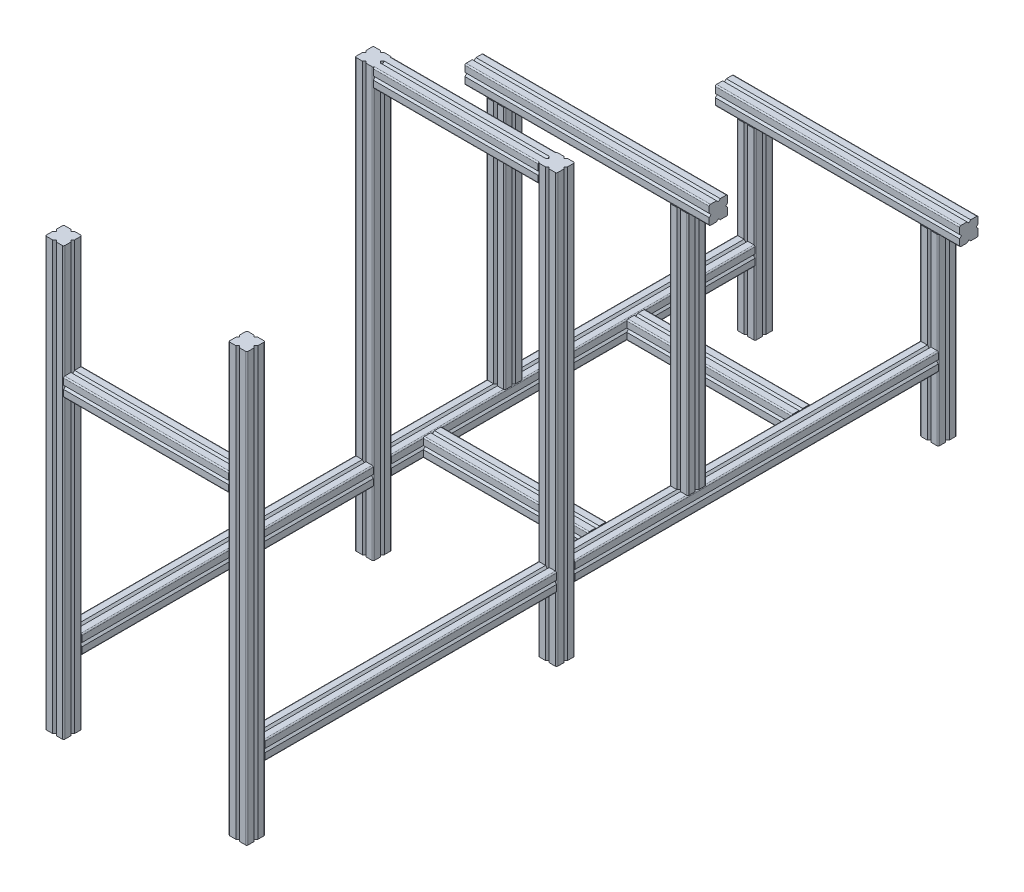
from build123d import *

# Parameters (mm, degrees)
EXTRUDE_1_DEPTH   = 700
EXTRUDE_1_2_DEPTH = 700
EXTRUDE_2_DEPTH   = 300
EXTRUDE_2_2_DEPTH = 300
EXTRUDE_3_DEPTH   = 700
EXTRUDE_3_2_DEPTH = 700
EXTRUDE_5_DEPTH   = 595
EXTRUDE_6_DEPTH   = 477
EXTRUDE_7_DEPTH   = 400
EXTRUDE_8_DEPTH   = 135
EXTRUDE_9_DEPTH   = 200


with BuildPart() as part:
    # 스케치1 → 보스-돌출1 (new body)
    with BuildSketch(Plane(origin=(0, 0, 0), x_dir=(1, 0, 0), z_dir=(0, 1, 0))):
        with BuildLine():
            Line((-163, 15), (-153, 15))
            Line((-153, 15), (-150, 12))
            Line((-150, 12), (-147, 15))
            Line((-147, 15), (-137, 15))
            ThreePointArc((-137, 15), (-135.585786438, 14.414213562), (-135, 13))
            Line((-135, 13), (-135, 3))
            Line((-135, 3), (-138, 0))
            Line((-138, 0), (-135, -3))
            Line((-135, -3), (-135, -13))
            ThreePointArc((-135, -13), (-135.585786438, -14.414213562), (-137, -15))
            Line((-137, -15), (-147, -15))
            Line((-147, -15), (-150, -12))
            Line((-150, -12), (-153, -15))
            Line((-153, -15), (-163, -15))
            ThreePointArc((-163, -15), (-164.414213562, -14.414213562), (-165, -13))
            Line((-165, -13), (-165, -3))
            Line((-165, -3), (-162, 0))
            Line((-162, 0), (-165, 3))
            Line((-165, 3), (-165, 13))
            ThreePointArc((-165, 13), (-164.414213562, 14.414213562), (-163, 15))
        make_face()
    extrude(amount=EXTRUDE_1_DEPTH)



with BuildPart() as body_2:
    # 스케치1 → Extrude 1 2 (new body)
    with BuildSketch(Plane(origin=(0, 0, 0), x_dir=(1, 0, 0), z_dir=(0, 1, 0))):
        with BuildLine():
            Line((147, -15), (137, -15))
            ThreePointArc((137, -15), (135.585786438, -14.414213562), (135, -13))
            Line((135, -13), (135, -3))
            Line((135, -3), (138, 0))
            Line((138, 0), (135, 3))
            Line((135, 3), (135, 13))
            ThreePointArc((135, 13), (135.585786438, 14.414213562), (137, 15))
            Line((137, 15), (147, 15))
            Line((147, 15), (150, 12))
            Line((150, 12), (153, 15))
            Line((153, 15), (163, 15))
            ThreePointArc((163, 15), (164.414213562, 14.414213562), (165, 13))
            Line((165, 13), (165, 3))
            Line((165, 3), (162, 0))
            Line((162, 0), (165, -3))
            Line((165, -3), (165, -13))
            ThreePointArc((165, -13), (164.414213562, -14.414213562), (163, -15))
            Line((163, -15), (153, -15))
            Line((153, -15), (150, -12))
            Line((150, -12), (147, -15))
        make_face()
    extrude(amount=EXTRUDE_1_2_DEPTH)


with BuildPart() as body_3:
    # 스케치2 → 보스-돌출2 (new body)
    with BuildSketch(Plane(origin=(0, 0, 0), x_dir=(1, 0, 0), z_dir=(0, 1, 0))):
        with BuildLine():
            Line((147, 640), (150, 637))
            Line((150, 637), (153, 640))
            Line((153, 640), (163, 640))
            ThreePointArc((163, 640), (164.414213562, 639.414213562), (165, 638))
            Line((165, 638), (165, 628))
            Line((165, 628), (162, 625))
            Line((162, 625), (165, 622))
            Line((165, 622), (165, 612))
            ThreePointArc((165, 612), (164.414213562, 610.585786438), (163, 610))
            Line((163, 610), (153, 610))
            Line((153, 610), (150, 613))
            Line((150, 613), (147, 610))
            Line((147, 610), (137, 610))
            ThreePointArc((137, 610), (135.585786438, 610.585786438), (135, 612))
            Line((135, 612), (135, 622))
            Line((135, 622), (138, 625))
            Line((138, 625), (135, 628))
            Line((135, 628), (135, 638))
            ThreePointArc((135, 638), (135.585786438, 639.414213562), (137, 640))
            Line((137, 640), (147, 640))
        make_face()
    extrude(amount=EXTRUDE_2_DEPTH)


with BuildPart() as body_4:
    # 스케치2 → Extrude 2 2 (new body)
    with BuildSketch(Plane(origin=(0, 0, 0), x_dir=(1, 0, 0), z_dir=(0, 1, 0))):
        with BuildLine():
            Line((-135, 628), (-135, 638))
            ThreePointArc((-135, 638), (-135.585786438, 639.414213562), (-137, 640))
            Line((-137, 640), (-147, 640))
            Line((-147, 640), (-150, 637))
            Line((-150, 637), (-153, 640))
            Line((-153, 640), (-163, 640))
            ThreePointArc((-163, 640), (-164.414213562, 639.414213562), (-165, 638))
            Line((-165, 638), (-165, 628))
            Line((-165, 628), (-162, 625))
            Line((-162, 625), (-165, 622))
            Line((-165, 622), (-165, 612))
            ThreePointArc((-165, 612), (-164.414213562, 610.585786438), (-163, 610))
            Line((-163, 610), (-153, 610))
            Line((-153, 610), (-150, 613))
            Line((-150, 613), (-147, 610))
            Line((-147, 610), (-137, 610))
            ThreePointArc((-137, 610), (-135.585786438, 610.585786438), (-135, 612))
            Line((-135, 612), (-135, 622))
            Line((-135, 622), (-138, 625))
            Line((-138, 625), (-135, 628))
        make_face()
    extrude(amount=EXTRUDE_2_2_DEPTH)


with BuildPart() as body_5:
    # 스케치3 → 보스-돌출3 (new body)
    with BuildSketch(Plane(origin=(0, 0, 0), x_dir=(1, 0, 0), z_dir=(0, 1, 0))):
        with BuildLine():
            Line((147, -492), (150, -495))
            Line((150, -495), (153, -492))
            Line((153, -492), (163, -492))
            ThreePointArc((163, -492), (164.414213562, -492.585786438), (165, -494))
            Line((165, -494), (165, -504))
            Line((165, -504), (162, -507))
            Line((162, -507), (165, -510))
            Line((165, -510), (165, -520))
            ThreePointArc((165, -520), (164.414213562, -521.414213562), (163, -522))
            Line((163, -522), (153, -522))
            Line((153, -522), (150, -519))
            Line((150, -519), (147, -522))
            Line((147, -522), (137, -522))
            ThreePointArc((137, -522), (135.585786438, -521.414213562), (135, -520))
            Line((135, -520), (135, -510))
            Line((135, -510), (138, -507))
            Line((138, -507), (135, -504))
            Line((135, -504), (135, -494))
            ThreePointArc((135, -494), (135.585786438, -492.585786438), (137, -492))
            Line((137, -492), (147, -492))
        make_face()
    extrude(amount=EXTRUDE_3_DEPTH)


with BuildPart() as body_6:
    # 스케치3 → Extrude 3 2 (new body)
    with BuildSketch(Plane(origin=(0, 0, 0), x_dir=(1, 0, 0), z_dir=(0, 1, 0))):
        with BuildLine():
            Line((-135, -504), (-135, -494))
            ThreePointArc((-135, -494), (-135.585786438, -492.585786438), (-137, -492))
            Line((-137, -492), (-147, -492))
            Line((-147, -492), (-150, -495))
            Line((-150, -495), (-153, -492))
            Line((-153, -492), (-163, -492))
            ThreePointArc((-163, -492), (-164.414213562, -492.585786438), (-165, -494))
            Line((-165, -494), (-165, -504))
            Line((-165, -504), (-162, -507))
            Line((-162, -507), (-165, -510))
            Line((-165, -510), (-165, -520))
            ThreePointArc((-165, -520), (-164.414213562, -521.414213562), (-163, -522))
            Line((-163, -522), (-153, -522))
            Line((-153, -522), (-150, -519))
            Line((-150, -519), (-147, -522))
            Line((-147, -522), (-137, -522))
            ThreePointArc((-137, -522), (-135.585786438, -521.414213562), (-135, -520))
            Line((-135, -520), (-135, -510))
            Line((-135, -510), (-138, -507))
            Line((-138, -507), (-135, -504))
        make_face()
    extrude(amount=EXTRUDE_3_2_DEPTH)


with BuildPart() as part_1:
    add(part.part)

    add(body_2.part)  # 보스-돌출5 merges body 2

    add(body_3.part)  # 보스-돌출5 merges body 3

    add(body_4.part)  # 보스-돌출5 merges body 4
    # 스케치5 → 보스-돌출5 (add)
    with BuildSketch(Plane(origin=(0, 0, -15), x_dir=(-1, 0, 0), z_dir=(0, 0, -1))):
        with BuildLine():
            Line((-163, 135), (-153, 135))
            Line((-153, 135), (-150, 132))
            Line((-150, 132), (-147, 135))
            Line((-147, 135), (-137, 135))
            ThreePointArc((-137, 135), (-135.585786438, 134.414213562), (-135, 133))
            Line((-135, 133), (-135, 123))
            Line((-135, 123), (-138, 120))
            Line((-138, 120), (-135, 117))
            Line((-135, 117), (-135, 107))
            ThreePointArc((-135, 107), (-135.585786438, 105.585786438), (-137, 105))
            Line((-137, 105), (-147, 105))
            Line((-147, 105), (-150, 108))
            Line((-150, 108), (-153, 105))
            Line((-153, 105), (-163, 105))
            ThreePointArc((-163, 105), (-164.414213562, 105.585786438), (-165, 107))
            Line((-165, 107), (-165, 117))
            Line((-165, 117), (-162, 120))
            Line((-162, 120), (-165, 123))
            Line((-165, 123), (-165, 133))
            ThreePointArc((-165, 133), (-164.414213562, 134.414213562), (-163, 135))
        make_face()
        with BuildLine():
            Line((165, 117), (165, 107))
            ThreePointArc((165, 107), (164.414213562, 105.585786438), (163, 105))
            Line((163, 105), (153, 105))
            Line((153, 105), (150, 108))
            Line((150, 108), (147, 105))
            Line((147, 105), (137, 105))
            ThreePointArc((137, 105), (135.585786438, 105.585786438), (135, 107))
            Line((135, 107), (135, 117))
            Line((135, 117), (138, 120))
            Line((138, 120), (135, 123))
            Line((135, 123), (135, 133))
            ThreePointArc((135, 133), (135.585786438, 134.414213562), (137, 135))
            Line((137, 135), (147, 135))
            Line((147, 135), (150, 132))
            Line((150, 132), (153, 135))
            Line((153, 135), (163, 135))
            ThreePointArc((163, 135), (164.414213562, 134.414213562), (165, 133))
            Line((165, 133), (165, 123))
            Line((165, 123), (162, 120))
            Line((162, 120), (165, 117))
        make_face()
    extrude(amount=EXTRUDE_5_DEPTH)


    add(body_5.part)  # 보스-돌출6 merges body 5

    add(body_6.part)  # 보스-돌출6 merges body 6
    # 스케치6 → 보스-돌출6 (add)
    with BuildSketch(Plane(origin=(0, 0, 492), x_dir=(-1, 0, 0), z_dir=(0, 0, -1))):
        with BuildLine():
            Line((-163, 105), (-153, 105))
            Line((-153, 105), (-150, 108))
            Line((-150, 108), (-147, 105))
            Line((-147, 105), (-137, 105))
            ThreePointArc((-137, 105), (-135.585786438, 105.585786438), (-135, 107))
            Line((-135, 107), (-135, 117))
            Line((-135, 117), (-138, 120))
            Line((-138, 120), (-135, 123))
            Line((-135, 123), (-135, 133))
            ThreePointArc((-135, 133), (-135.585786438, 134.414213562), (-137, 135))
            Line((-137, 135), (-147, 135))
            Line((-147, 135), (-150, 132))
            Line((-150, 132), (-153, 135))
            Line((-153, 135), (-163, 135))
            ThreePointArc((-163, 135), (-164.414213562, 134.414213562), (-165, 133))
            Line((-165, 133), (-165, 123))
            Line((-165, 123), (-162, 120))
            Line((-162, 120), (-165, 117))
            Line((-165, 117), (-165, 107))
            ThreePointArc((-165, 107), (-164.414213562, 105.585786438), (-163, 105))
        make_face()
        with BuildLine():
            Line((135, 123), (135, 133))
            ThreePointArc((135, 133), (135.585786438, 134.414213562), (137, 135))
            Line((137, 135), (147, 135))
            Line((147, 135), (150, 132))
            Line((150, 132), (153, 135))
            Line((153, 135), (163, 135))
            ThreePointArc((163, 135), (164.414213562, 134.414213562), (165, 133))
            Line((165, 133), (165, 123))
            Line((165, 123), (162, 120))
            Line((162, 120), (165, 117))
            Line((165, 117), (165, 107))
            ThreePointArc((165, 107), (164.414213562, 105.585786438), (163, 105))
            Line((163, 105), (153, 105))
            Line((153, 105), (150, 108))
            Line((150, 108), (147, 105))
            Line((147, 105), (137, 105))
            ThreePointArc((137, 105), (135.585786438, 105.585786438), (135, 107))
            Line((135, 107), (135, 117))
            Line((135, 117), (138, 120))
            Line((138, 120), (135, 123))
        make_face()
    extrude(amount=EXTRUDE_6_DEPTH)

    # 스케치7 → 보스-돌출7 (add)
    with BuildSketch(Plane(origin=(0, 135, 0), x_dir=(1, 0, 0), z_dir=(0, 1, 0))):
        with BuildLine():
            Line((137, 230), (147, 230))
            Line((147, 230), (150, 227))
            Line((150, 227), (153, 230))
            Line((153, 230), (163, 230))
            ThreePointArc((163, 230), (164.414213562, 229.414213562), (165, 228))
            Line((165, 228), (165, 218))
            Line((165, 218), (162, 215))
            Line((162, 215), (165, 212))
            Line((165, 212), (165, 202))
            ThreePointArc((165, 202), (164.414213562, 200.585786438), (163, 200))
            Line((163, 200), (153, 200))
            Line((153, 200), (150, 203))
            Line((150, 203), (147, 200))
            Line((147, 200), (137, 200))
            ThreePointArc((137, 200), (135.585786438, 200.585786438), (135, 202))
            Line((135, 202), (135, 212))
            Line((135, 212), (138, 215))
            Line((138, 215), (135, 218))
            Line((135, 218), (135, 228))
            ThreePointArc((135, 228), (135.585786438, 229.414213562), (137, 230))
        make_face()
        with BuildLine():
            Line((-165, 212), (-165, 202))
            ThreePointArc((-165, 202), (-164.414213562, 200.585786438), (-163, 200))
            Line((-163, 200), (-153, 200))
            Line((-153, 200), (-150, 203))
            Line((-150, 203), (-147, 200))
            Line((-147, 200), (-137, 200))
            ThreePointArc((-137, 200), (-135.585786438, 200.585786438), (-135, 202))
            Line((-135, 202), (-135, 212))
            Line((-135, 212), (-138, 215))
            Line((-138, 215), (-135, 218))
            Line((-135, 218), (-135, 228))
            ThreePointArc((-135, 228), (-135.585786438, 229.414213562), (-137, 230))
            Line((-137, 230), (-147, 230))
            Line((-147, 230), (-150, 227))
            Line((-150, 227), (-153, 230))
            Line((-153, 230), (-163, 230))
            ThreePointArc((-163, 230), (-164.414213562, 229.414213562), (-165, 228))
            Line((-165, 228), (-165, 218))
            Line((-165, 218), (-162, 215))
            Line((-162, 215), (-165, 212))
        make_face()
    extrude(amount=EXTRUDE_7_DEPTH)

    # 스케치8 → 보스-돌출8 (add, symmetric)
    with BuildSketch(Plane(origin=(0, 0, 0), x_dir=(0, 0, -1), z_dir=(1, 0, 0))):
        with BuildLine():
            Line((-3, 700), (0, 697))
            Line((0, 697), (3, 700))
            Line((3, 700), (13, 700))
            ThreePointArc((13, 700), (14.414213562, 699.414213562), (15, 698))
            Line((15, 698), (15, 688))
            Line((15, 688), (12, 685))
            Line((12, 685), (15, 682))
            Line((15, 682), (15, 672))
            ThreePointArc((15, 672), (14.414213562, 670.585786438), (13, 670))
            Line((13, 670), (3, 670))
            Line((3, 670), (0, 673))
            Line((0, 673), (-3, 670))
            Line((-3, 670), (-13, 670))
            ThreePointArc((-13, 670), (-14.414213562, 670.585786438), (-15, 672))
            Line((-15, 672), (-15, 682))
            Line((-15, 682), (-12, 685))
            Line((-12, 685), (-15, 688))
            Line((-15, 688), (-15, 698))
            ThreePointArc((-15, 698), (-14.414213562, 699.414213562), (-13, 700))
            Line((-13, 700), (-3, 700))
        make_face()
        with BuildLine():
            Line((79, 135), (82, 132))
            Line((82, 132), (85, 135))
            Line((85, 135), (95, 135))
            ThreePointArc((95, 135), (96.414213562, 134.414213562), (97, 133))
            Line((97, 133), (97, 123))
            Line((97, 123), (94, 120))
            Line((94, 120), (97, 117))
            Line((97, 117), (97, 107))
            ThreePointArc((97, 107), (96.414213562, 105.585786438), (95, 105))
            Line((95, 105), (85, 105))
            Line((85, 105), (82, 108))
            Line((82, 108), (79, 105))
            Line((79, 105), (69, 105))
            ThreePointArc((69, 105), (67.585786438, 105.585786438), (67, 107))
            Line((67, 107), (67, 117))
            Line((67, 117), (70, 120))
            Line((70, 120), (67, 123))
            Line((67, 123), (67, 133))
            ThreePointArc((67, 133), (67.585786438, 134.414213562), (69, 135))
            Line((69, 135), (79, 135))
        make_face()
        with BuildLine():
            Line((412, 135), (415, 132))
            Line((415, 132), (418, 135))
            Line((418, 135), (428, 135))
            ThreePointArc((428, 135), (429.414213562, 134.414213562), (430, 133))
            Line((430, 133), (430, 123))
            Line((430, 123), (427, 120))
            Line((427, 120), (430, 117))
            Line((430, 117), (430, 107))
            ThreePointArc((430, 107), (429.414213562, 105.585786438), (428, 105))
            Line((428, 105), (418, 105))
            Line((418, 105), (415, 108))
            Line((415, 108), (412, 105))
            Line((412, 105), (402, 105))
            ThreePointArc((402, 105), (400.585786438, 105.585786438), (400, 107))
            Line((400, 107), (400, 117))
            Line((400, 117), (403, 120))
            Line((403, 120), (400, 123))
            Line((400, 123), (400, 133))
            ThreePointArc((400, 133), (400.585786438, 134.414213562), (402, 135))
            Line((402, 135), (412, 135))
        make_face()
        with BuildLine():
            Line((-510, 515), (-507, 512))
            Line((-507, 512), (-504, 515))
            Line((-504, 515), (-494, 515))
            ThreePointArc((-494, 515), (-492.585786438, 514.414213562), (-492, 513))
            Line((-492, 513), (-492, 503))
            Line((-492, 503), (-495, 500))
            Line((-495, 500), (-492, 497))
            Line((-492, 497), (-492, 487))
            ThreePointArc((-492, 487), (-492.585786438, 485.585786438), (-494, 485))
            Line((-494, 485), (-504, 485))
            Line((-504, 485), (-507, 488))
            Line((-507, 488), (-510, 485))
            Line((-510, 485), (-520, 485))
            ThreePointArc((-520, 485), (-521.414213562, 485.585786438), (-522, 487))
            Line((-522, 487), (-522, 497))
            Line((-522, 497), (-519, 500))
            Line((-519, 500), (-522, 503))
            Line((-522, 503), (-522, 513))
            ThreePointArc((-522, 513), (-521.414213562, 514.414213562), (-520, 515))
            Line((-520, 515), (-510, 515))
        make_face()
    extrude(amount=EXTRUDE_8_DEPTH, both=True)

    # 스케치9 → 보스-돌출9 (add, symmetric)
    with BuildSketch(Plane(origin=(0, 0, 0), x_dir=(0, 0, -1), z_dir=(1, 0, 0))):
        with BuildLine():
            Line((212, 565), (215, 562))
            Line((215, 562), (218, 565))
            Line((218, 565), (228, 565))
            ThreePointArc((228, 565), (229.414213562, 564.414213562), (230, 563))
            Line((230, 563), (230, 553))
            Line((230, 553), (227, 550))
            Line((227, 550), (230, 547))
            Line((230, 547), (230, 537))
            ThreePointArc((230, 537), (229.414213562, 535.585786438), (228, 535))
            Line((228, 535), (218, 535))
            Line((218, 535), (215, 538))
            Line((215, 538), (212, 535))
            Line((212, 535), (202, 535))
            ThreePointArc((202, 535), (200.585786438, 535.585786438), (200, 537))
            Line((200, 537), (200, 547))
            Line((200, 547), (203, 550))
            Line((203, 550), (200, 553))
            Line((200, 553), (200, 563))
            ThreePointArc((200, 563), (200.585786438, 564.414213562), (202, 565))
            Line((202, 565), (212, 565))
        make_face()
        with BuildLine():
            Line((622, 330), (625, 327))
            Line((625, 327), (628, 330))
            Line((628, 330), (638, 330))
            ThreePointArc((638, 330), (639.414213562, 329.414213562), (640, 328))
            Line((640, 328), (640, 318))
            Line((640, 318), (637, 315))
            Line((637, 315), (640, 312))
            Line((640, 312), (640, 302))
            ThreePointArc((640, 302), (639.414213562, 300.585786438), (638, 300))
            Line((638, 300), (628, 300))
            Line((628, 300), (625, 303))
            Line((625, 303), (622, 300))
            Line((622, 300), (612, 300))
            ThreePointArc((612, 300), (610.585786438, 300.585786438), (610, 302))
            Line((610, 302), (610, 312))
            Line((610, 312), (613, 315))
            Line((613, 315), (610, 318))
            Line((610, 318), (610, 328))
            ThreePointArc((610, 328), (610.585786438, 329.414213562), (612, 330))
            Line((612, 330), (622, 330))
        make_face()
    extrude(amount=EXTRUDE_9_DEPTH, both=True)


solid = part_1.part
